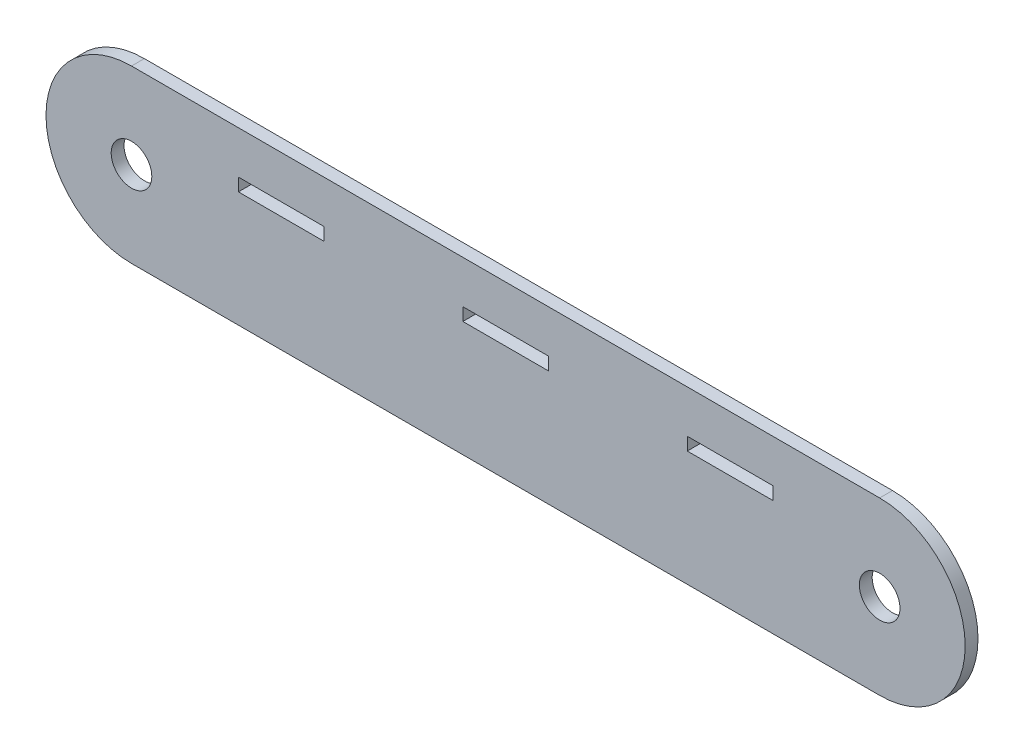
from build123d import *

# Parameters (mm, degrees)
SKETCH1_R           = 9.5
SKETCH1_W           = 40
SKETCH1_H           = 6
BOSS_EXTRUDE1_DEPTH = 6


with BuildPart() as part:
    # Sketch1 → Boss-Extrude1 (new body)
    with BuildSketch(Plane.XY):
        with BuildLine():
            Line((-35.529687849, 42.131147541), (314.470312151, 42.131147541))
            ThreePointArc((314.470312151, 42.131147541), (354.470312151, 2.131147541), (314.470312151, -37.868852459))
            Line((314.470312151, -37.868852459), (-35.529687849, -37.868852459))
            ThreePointArc((-35.529687849, -37.868852459), (-75.529687849, 2.131147541), (-35.529687849, 42.131147541))
        make_face()
        with Locations((-35.529687849, 2.131147541)):
            Circle(SKETCH1_R, mode=Mode.SUBTRACT)
        with Locations((314.470312151, 2.131147541)):
            Circle(SKETCH1_R, mode=Mode.SUBTRACT)
        with Locations((139.470312151, 19.131147541)):
            Rectangle(SKETCH1_W, SKETCH1_H, mode=Mode.SUBTRACT)
        with Locations((244.470312151, 19.131147541)):
            Rectangle(SKETCH1_W, SKETCH1_H, mode=Mode.SUBTRACT)
        with Locations((34.470312151, 19.131147541)):
            Rectangle(SKETCH1_W, SKETCH1_H, mode=Mode.SUBTRACT)
    extrude(amount=BOSS_EXTRUDE1_DEPTH)


solid = part.part
